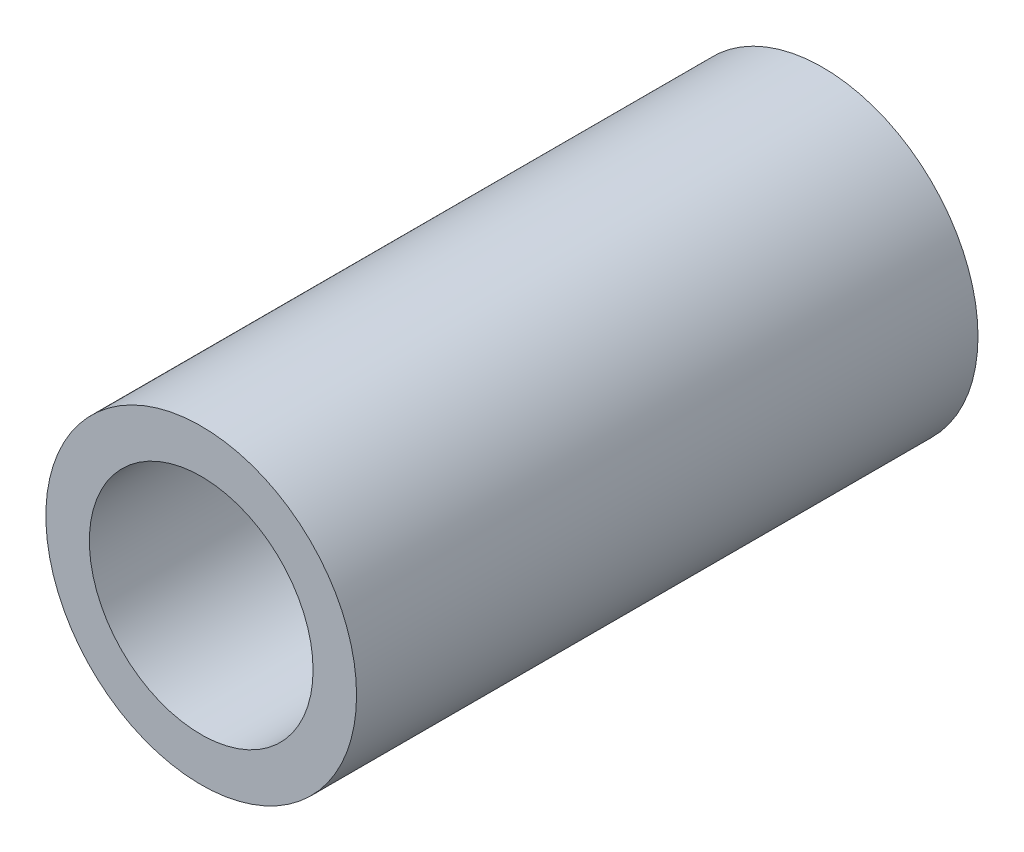
from build123d import *

# Parameters (mm, degrees)
EXTRUDE1_DEPTH      = 3.175
EXTRUDE1_DEPTH_BACK = 3.175
SKETCH1_R           = 1.5875
SKETCH1_R_2         = 1.143


with BuildPart() as part:
    # Sketch1 → Extrude1 (new, two sides: drawn at the far end of the back side and taken through both)
    with BuildSketch(Plane.XY.offset(-EXTRUDE1_DEPTH_BACK)):
        Circle(SKETCH1_R)
        Circle(SKETCH1_R_2, mode=Mode.SUBTRACT)
    extrude(amount=EXTRUDE1_DEPTH + EXTRUDE1_DEPTH_BACK)


solid = part.part
